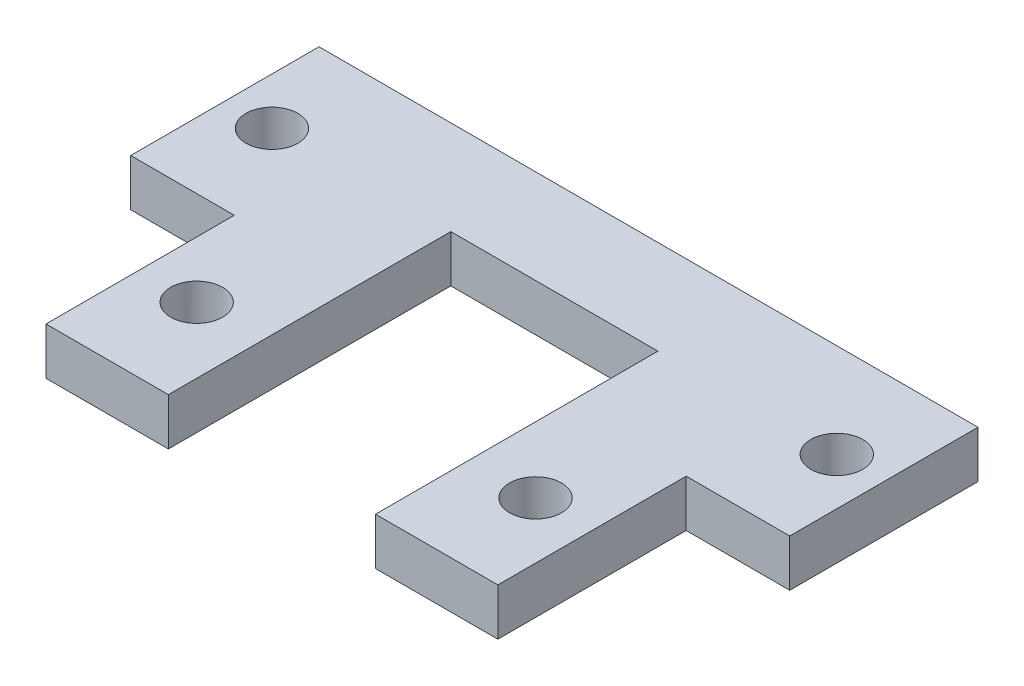
from build123d import *

# Parameters (mm, degrees)
SKETCH1_W           = 44.45
SKETCH1_H           = 12.7
SKETCH1_R           = 1.75
SKETCH1_W_2         = 30.48
BOSS_EXTRUDE1_DEPTH = 3.175
SKETCH2_R           = 1.75
CUT_EXTRUDE1_DEPTH  = 12.192
SKETCH3_W           = 13.97
SKETCH3_H           = 19.05
CUT_EXTRUDE2_DEPTH  = 25.4


with BuildPart() as part:
    # Sketch1 → Boss-Extrude1 (new body)
    # profile 1 of 2: a face of its own
    with BuildSketch(Plane(origin=(0, 0, 0), x_dir=(-1, 0, 0), z_dir=(0, 1, 0))):
        Rectangle(SKETCH1_W, SKETCH1_H)
        with Locations(Location((19.05, 0, 0), (0, 0, 90))):
            Circle(SKETCH1_R, mode=Mode.SUBTRACT)
        with Locations(Location((-19.05, 0, 0), (0, 0, 90))):
            Circle(SKETCH1_R, mode=Mode.SUBTRACT)
    # profile 2 of 2: a face of its own
    with BuildSketch(Plane(origin=(0, 0, 0), x_dir=(-1, 0, 0), z_dir=(0, 1, 0))):
        with Locations((0, 12.7)):
            Rectangle(SKETCH1_W_2, SKETCH1_H)
    extrude(amount=BOSS_EXTRUDE1_DEPTH)

    # Sketch2 → Cut-Extrude1 (cut)
    with BuildSketch(Plane(origin=(0, 3.175, 0), x_dir=(-1, 0, 0), z_dir=(0, 1, 0))):
        with Locations(Location((-11.43, 12.7, 0), (0, 0, 90))):
            Circle(SKETCH2_R)
        with Locations(Location((11.43, 12.7, 0), (0, 0, 90))):
            Circle(SKETCH2_R)
    extrude(amount=-CUT_EXTRUDE1_DEPTH, mode=Mode.SUBTRACT)

    # Sketch3 → Cut-Extrude2 (cut)
    with BuildSketch(Plane(origin=(0, 3.175, 0), x_dir=(-1, 0, 0), z_dir=(0, 1, 0))):
        with Locations((0, 9.525)):
            Rectangle(SKETCH3_W, SKETCH3_H)
    extrude(amount=-CUT_EXTRUDE2_DEPTH, mode=Mode.SUBTRACT)


solid = part.part
